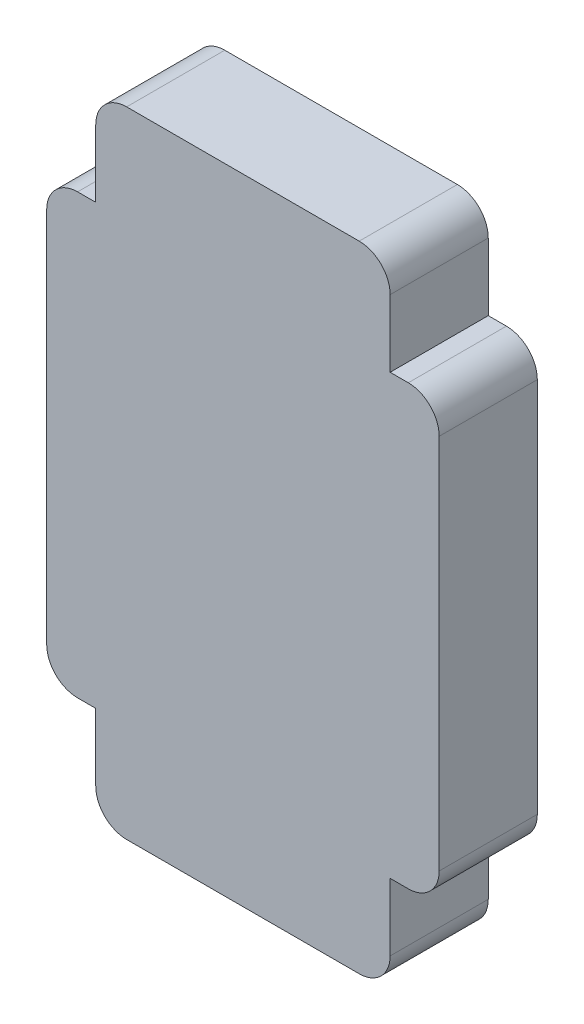
from build123d import *

# Parameters (mm, degrees)
SKETCH1_W           = 9.525
SKETCH1_H           = 3.175
BOSS_EXTRUDE1_DEPTH = 3.175
FILLET1_R           = 1


with BuildPart() as part:
    # Sketch1 → Boss-Extrude1 (new body)
    with BuildSketch(Plane.XY):
        with Locations((0, -8.6775)):
            Rectangle(SKETCH1_W, SKETCH1_H)
        Polygon((4.7625, 7.09), (-4.7625, 7.09), (-6.35, 7.09), (-6.35, -7.09), (-4.7625, -7.09), (4.7625, -7.09), (6.35, -7.09), (6.35, 7.09), align=None)
        with Locations((0, 8.6775)):
            Rectangle(SKETCH1_W, SKETCH1_H)
    extrude(amount=BOSS_EXTRUDE1_DEPTH)

    # Fillet1
    fillet1_edges = [part.edges().sort_by_distance(p)[0] for p in [
        (-6.35, -7.09, 1.5875),
        (-6.35, 7.09, 1.5875),
        (-4.7625, 10.265, 1.5875),
        (4.7625, 10.265, 1.5875),
        (6.35, 7.09, 1.5875),
        (6.35, -7.09, 1.5875),
        (4.7625, -10.265, 1.5875),
        (-4.7625, -10.265, 1.5875),
    ]]
    fillet(fillet1_edges, radius=FILLET1_R)


solid = part.part
